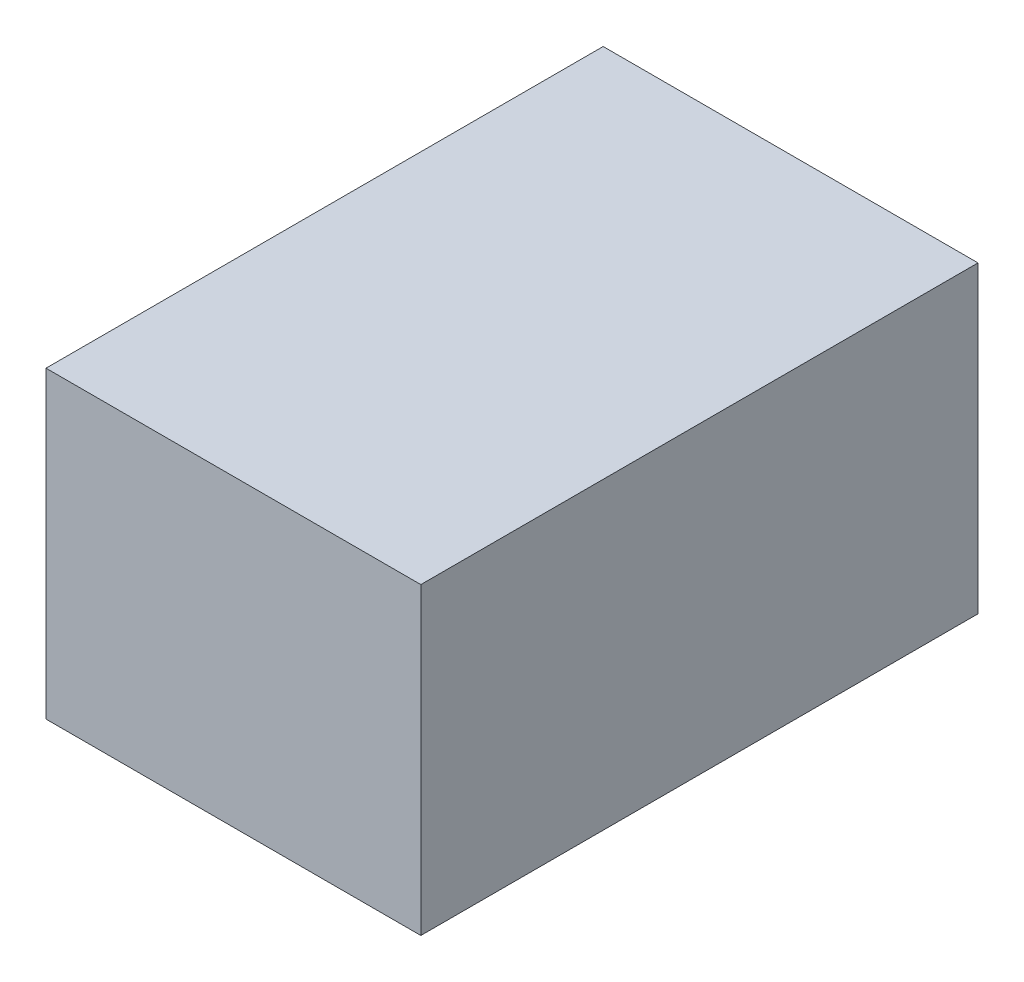
from build123d import *

# Parameters (mm, degrees)
ESQUISSE1_W        = 37
ESQUISSE1_H        = 55
BOSS_EXTRU_1_DEPTH = 30


with BuildPart() as part:
    # Esquisse1 → Boss.-Extru.1 (new body)
    with BuildSketch(Plane(origin=(0, 0, 0), x_dir=(1, 0, 0), z_dir=(0, 1, 0))):
        with Locations((18.5, 27.5)):
            Rectangle(ESQUISSE1_W, ESQUISSE1_H)
    extrude(amount=BOSS_EXTRU_1_DEPTH)


solid = part.part
